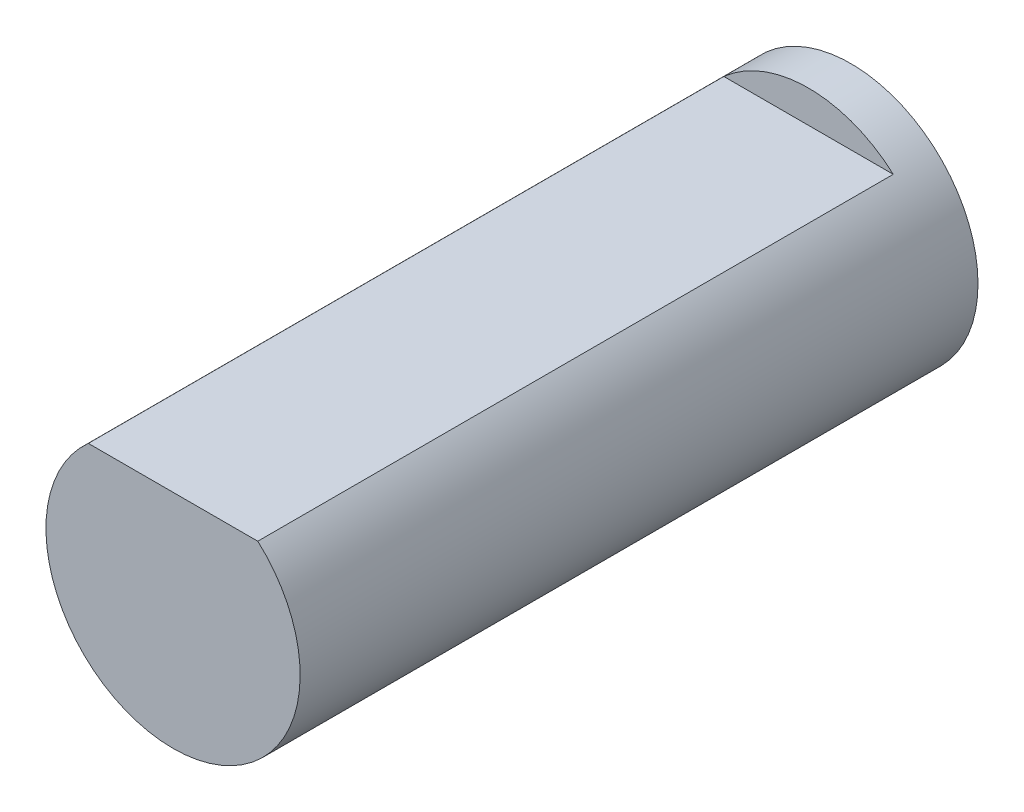
from build123d import *

# Parameters (mm, degrees)
SKETCH_1_R      = 1.5
EXTRUDE_1_DEPTH = 0.5
EXTRUDE_2_DEPTH = 7.5


with BuildPart() as part:
    # 草图1 → 凸台-拉伸1 (new body)
    with BuildSketch(Plane.XY):
        Circle(SKETCH_1_R)
    extrude(amount=EXTRUDE_1_DEPTH)

    # 草图2 → 凸台-拉伸2 (add)
    with BuildSketch(Plane.XY.offset(0.5)):
        with BuildLine():
            Line((-1, 1.118033989), (1, 1.118033989))
            ThreePointArc((1, 1.118033989), (0, -1.5), (-1, 1.118033989))
        make_face()
    extrude(amount=EXTRUDE_2_DEPTH)


solid = part.part
